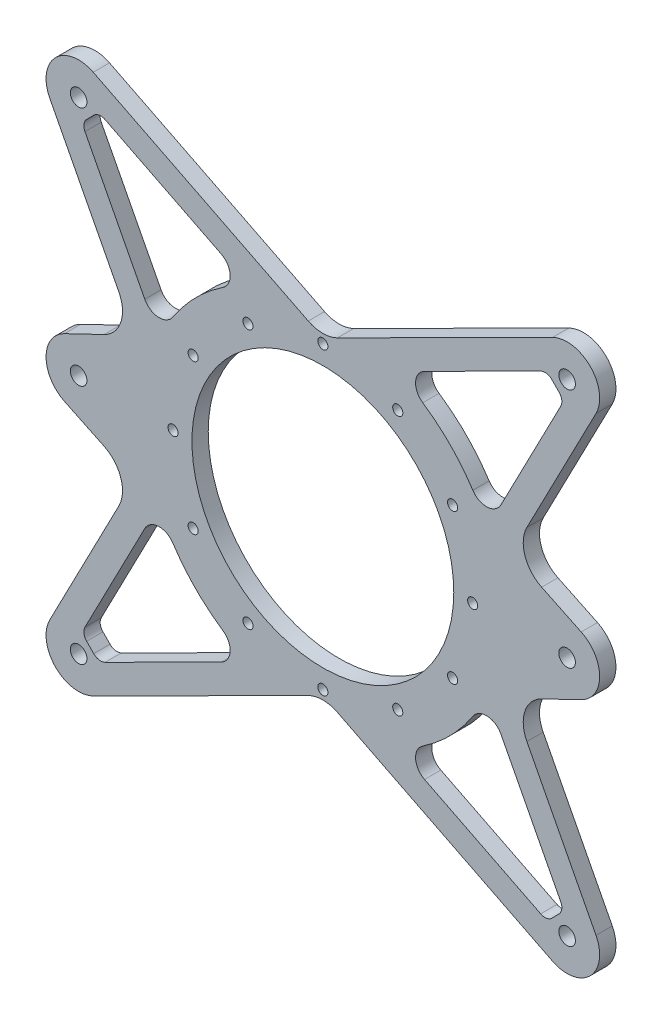
from build123d import *
from OCP.BRepFilletAPI import BRepFilletAPI_MakeFillet

# Parameters (mm, degrees)
SKETCH_1_W          = 170
SKETCH_1_H          = 168
EXTRUDE_1_DEPTH     = 5
SKETCH_3_R          = 40.2
CUT_EXTRUDE_1_DEPTH = 8
SKETCH_5_R          = 2.55
CUT_EXTRUDE_2_DEPTH = 8
SKETCH_7_OUTSIDE_W  = 219.812
SKETCH_7_OUTSIDE_H  = 217.812
CUT_EXTRUDE_3_DEPTH = 8
CUT_EXTRUDE_4_DEPTH = 8
FILLET_1_R          = 10
FILLET_2_R1         = 3
FILLET_2_R2         = 5
SKETCH_9_R          = 1.55
CUT_EXTRUDE_5_DEPTH = 30


with BuildPart() as part:
    # 草图1 → 凸台-拉伸1 (new body)
    with BuildSketch(Plane.XY):
        Rectangle(SKETCH_1_W, SKETCH_1_H)
    extrude(amount=EXTRUDE_1_DEPTH)

    # 草图3 → 切除-拉伸1 (cut)
    with BuildSketch(Plane.XY.offset(5)):
        Circle(SKETCH_3_R)
    extrude(amount=-CUT_EXTRUDE_1_DEPTH, mode=Mode.SUBTRACT)

    # 草图5 → 切除-拉伸2 (cut)
    with BuildSketch(Plane.XY.offset(5)):
        with Locations((75, 0)):
            Circle(SKETCH_5_R)
        with Locations((75, -74)):
            Circle(SKETCH_5_R)
        with Locations((75, 74)):
            Circle(SKETCH_5_R)
    cut_extrude_2 = extrude(amount=-CUT_EXTRUDE_2_DEPTH, mode=Mode.SUBTRACT)

    # 镜向1: 切除-拉伸2 across plane
    add(cut_extrude_2.mirror(Plane(origin=(0, 0, 0), x_dir=(0, 0, 1), z_dir=(1, 0, 0))), mode=Mode.SUBTRACT)

    # 草图7 outside → 切除-拉伸3 (cut)
    with BuildSketch(Plane.XY.offset(5)):
        Rectangle(SKETCH_7_OUTSIDE_W, SKETCH_7_OUTSIDE_H)
        with BuildLine():
            Line((70.514783337, 82.937719591), (0, 47.551279236))
            Line((0, 47.551279236), (-70.514783337, 82.937719591))
            ThreePointArc((-70.514783337, 82.937719591), (-82.118364328, 81.023452804), (-83.876712925, 69.395223387))
            Line((-83.876712925, 69.395223387), (-57.899389351, 19.318256945))
            Line((-57.899389351, 19.318256945), (-79.333333333, 9.012337223))
            ThreePointArc((-79.333333333, 9.012337223), (-85, 0), (-79.333333333, -9.012337223))
            Line((-79.333333333, -9.012337223), (-57.899389351, -19.318256945))
            Line((-57.899389351, -19.318256945), (-83.876712925, -69.395223387))
            ThreePointArc((-83.876712925, -69.395223387), (-82.118364328, -81.023452804), (-70.514783337, -82.937719591))
            Line((-70.514783337, -82.937719591), (0, -47.551279236))
            Line((0, -47.551279236), (70.514783337, -82.937719591))
            ThreePointArc((70.514783337, -82.937719591), (82.118364328, -81.023452804), (83.876712925, -69.395223387))
            Line((83.876712925, -69.395223387), (57.899389351, -19.318256945))
            Line((57.899389351, -19.318256945), (79.333333333, -9.012337223))
            ThreePointArc((79.333333333, -9.012337223), (85, 0), (79.333333333, 9.012337223))
            Line((79.333333333, 9.012337223), (57.899389351, 19.318256945))
            Line((57.899389351, 19.318256945), (83.876712925, 69.395223387))
            ThreePointArc((83.876712925, 69.395223387), (82.118364328, 81.023452804), (70.514783337, 82.937719591))
        make_face(mode=Mode.SUBTRACT)
    extrude(amount=-CUT_EXTRUDE_3_DEPTH, mode=Mode.SUBTRACT)

    # 草图8 → 切除-拉伸4 (cut)
    with BuildSketch(Plane.XY.offset(5)):
        with BuildLine():
            Line((-68.825352327, 73.139083236), (-74.056283345, 67.837463961))
            Line((-74.056283345, 67.837463961), (-50.348751369, 22.136016704))
            ThreePointArc((-50.348751369, 22.136016704), (-39.151003806, 38.628990422), (-22.809814375, 50.047101496))
            Line((-22.809814375, 50.047101496), (-68.825352327, 73.139083236))
        make_face()
        with BuildLine():
            ThreePointArc((-22.809814375, -50.047101496), (-39.151003806, -38.628990422), (-50.348751369, -22.136016704))
            Line((-50.348751369, -22.136016704), (-74.056283345, -67.837463961))
            Line((-74.056283345, -67.837463961), (-68.825352327, -73.139083236))
            Line((-68.825352327, -73.139083236), (-22.809814375, -50.047101496))
        make_face()
        with BuildLine():
            Line((68.825352327, 73.139083236), (22.809814375, 50.047101496))
            ThreePointArc((22.809814375, 50.047101496), (39.151003806, 38.628990422), (50.348751369, 22.136016704))
            Line((50.348751369, 22.136016704), (74.056283345, 67.837463961))
            Line((74.056283345, 67.837463961), (68.825352327, 73.139083236))
        make_face()
        with BuildLine():
            ThreePointArc((50.348751369, -22.136016704), (39.151003806, -38.628990422), (22.809814375, -50.047101496))
            Line((22.809814375, -50.047101496), (68.825352327, -73.139083236))
            Line((68.825352327, -73.139083236), (74.056283345, -67.837463961))
            Line((74.056283345, -67.837463961), (50.348751369, -22.136016704))
        make_face()
    extrude(amount=-CUT_EXTRUDE_4_DEPTH, mode=Mode.SUBTRACT)

    # 圆角1
    fillet_1_edges = [part.edges().sort_by_distance(p)[0] for p in [
        (0, 47.551279236, 2.5),
        (-57.899389351, 19.318256945, 2.5),
        (-57.899389351, -19.318256945, 2.5),
        (57.899389351, 19.318256945, 2.5),
        (57.899389351, -19.318256945, 2.5),
        (0, -47.551279236, 2.5),
    ]]
    fillet(fillet_1_edges, radius=FILLET_1_R)

    # 圆角2: one fillet with a radius per group of edges: ONE call of the kernel's fillet builder (fillet() takes one radius for all edges)
    fillet_2_edges_1 = [part.edges().sort_by_distance(p)[0] for p in [
        (-74.056283345, -67.837463961, 2.5),
        (-68.825352327, -73.139083236, 2.5),
        (68.825352327, -73.139083236, 2.5),
        (74.056283345, -67.837463961, 2.5),
        (-68.825352327, 73.139083236, 2.5),
        (-74.056283345, 67.837463961, 2.5),
        (74.056283345, 67.837463961, 2.5),
        (68.825352327, 73.139083236, 2.5),
    ]]
    fillet_2_edges_2 = [part.edges().sort_by_distance(p)[0] for p in [
        (50.348751369, -22.136016704, 2.5),
        (22.809814375, -50.047101496, 2.5),
        (-22.809814375, -50.047101496, 2.5),
        (-50.348751369, -22.136016704, 2.5),
        (-50.348751369, 22.136016704, 2.5),
        (-22.809814375, 50.047101496, 2.5),
        (22.809814375, 50.047101496, 2.5),
        (50.348751369, 22.136016704, 2.5),
    ]]
    fillet_2 = BRepFilletAPI_MakeFillet(part.part.solid().wrapped)
    for e in fillet_2_edges_1:
        fillet_2.Add(FILLET_2_R1, e.wrapped)
    for e in fillet_2_edges_2:
        fillet_2.Add(FILLET_2_R2, e.wrapped)
    add(Compound.cast(fillet_2.Shape()), mode=Mode.REPLACE)

    # 草图9 → 切除-拉伸5 (cut)
    with BuildSketch(Plane.XY.offset(5)):
        with Locations((0, 46)):
            Circle(SKETCH_9_R)
        with Locations((23, 39.837168574)):
            Circle(SKETCH_9_R)
        with Locations((39.837168574, 23)):
            Circle(SKETCH_9_R)
        with Locations((46, 0)):
            Circle(SKETCH_9_R)
        with Locations((39.837168574, -23)):
            Circle(SKETCH_9_R)
        with Locations((23, -39.837168574)):
            Circle(SKETCH_9_R)
        with Locations((0, -46)):
            Circle(SKETCH_9_R)
        with Locations((-23, -39.837168574)):
            Circle(SKETCH_9_R)
        with Locations((-39.837168574, -23)):
            Circle(SKETCH_9_R)
        with Locations((-46, 0)):
            Circle(SKETCH_9_R)
        with Locations((-39.837168574, 23)):
            Circle(SKETCH_9_R)
        with Locations((-23, 39.837168574)):
            Circle(SKETCH_9_R)
    extrude(amount=-CUT_EXTRUDE_5_DEPTH, mode=Mode.SUBTRACT)


solid = part.part
